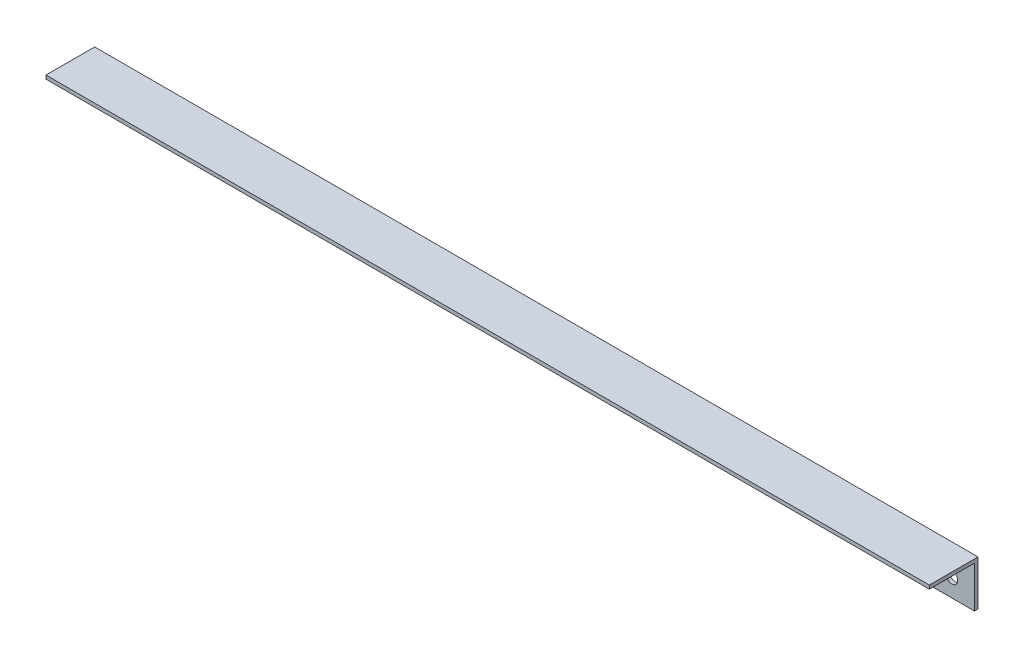
from build123d import *

# Parameters (mm, degrees)
SKETCH_1_W        = 1960
SKETCH_1_H        = 100
SKETCH_1_R        = 13
EXTRUDE_711_DEPTH = 8
SKETCH_2_W        = 1960
SKETCH_2_H        = 8
EXTRUDE_1_DEPTH   = 100


with BuildPart() as part:
    # 草图1 → Extrude 711 (new body)
    with BuildSketch(Plane.XY):
        with Locations((0, 44.512115183)):
            Rectangle(SKETCH_1_W, SKETCH_1_H)
        with Locations((930, 34.512115183)):
            Circle(SKETCH_1_R, mode=Mode.SUBTRACT)
        with Locations((850, 34.512115183)):
            Circle(SKETCH_1_R, mode=Mode.SUBTRACT)
        with Locations((770, 34.512115183)):
            Circle(SKETCH_1_R, mode=Mode.SUBTRACT)
        with Locations((330, 34.512115183)):
            Circle(SKETCH_1_R, mode=Mode.SUBTRACT)
        with Locations((250, 34.512115183)):
            Circle(SKETCH_1_R, mode=Mode.SUBTRACT)
        with Locations(Location((-770, 34.512115183, 0), (0, 0, 180))):
            Circle(SKETCH_1_R, mode=Mode.SUBTRACT)
        with Locations(Location((-850, 34.512115183, 0), (0, 0, 180))):
            Circle(SKETCH_1_R, mode=Mode.SUBTRACT)
        with Locations((170, 34.512115183)):
            Circle(SKETCH_1_R, mode=Mode.SUBTRACT)
        with Locations(Location((-170, 34.512115183, 0), (0, 0, 180))):
            Circle(SKETCH_1_R, mode=Mode.SUBTRACT)
        with Locations(Location((-250, 34.512115183, 0), (0, 0, 180))):
            Circle(SKETCH_1_R, mode=Mode.SUBTRACT)
        with Locations(Location((-330, 34.512115183, 0), (0, 0, 180))):
            Circle(SKETCH_1_R, mode=Mode.SUBTRACT)
        with Locations(Location((-930, 34.512115183, 0), (0, 0, 180))):
            Circle(SKETCH_1_R, mode=Mode.SUBTRACT)
    extrude(amount=EXTRUDE_711_DEPTH)

    # 草图2 → 凸台-拉伸1 (add)
    with BuildSketch(Plane.XY.offset(8)):
        with Locations((0, 90.512115183)):
            Rectangle(SKETCH_2_W, SKETCH_2_H)
    extrude(amount=EXTRUDE_1_DEPTH)


solid = part.part
